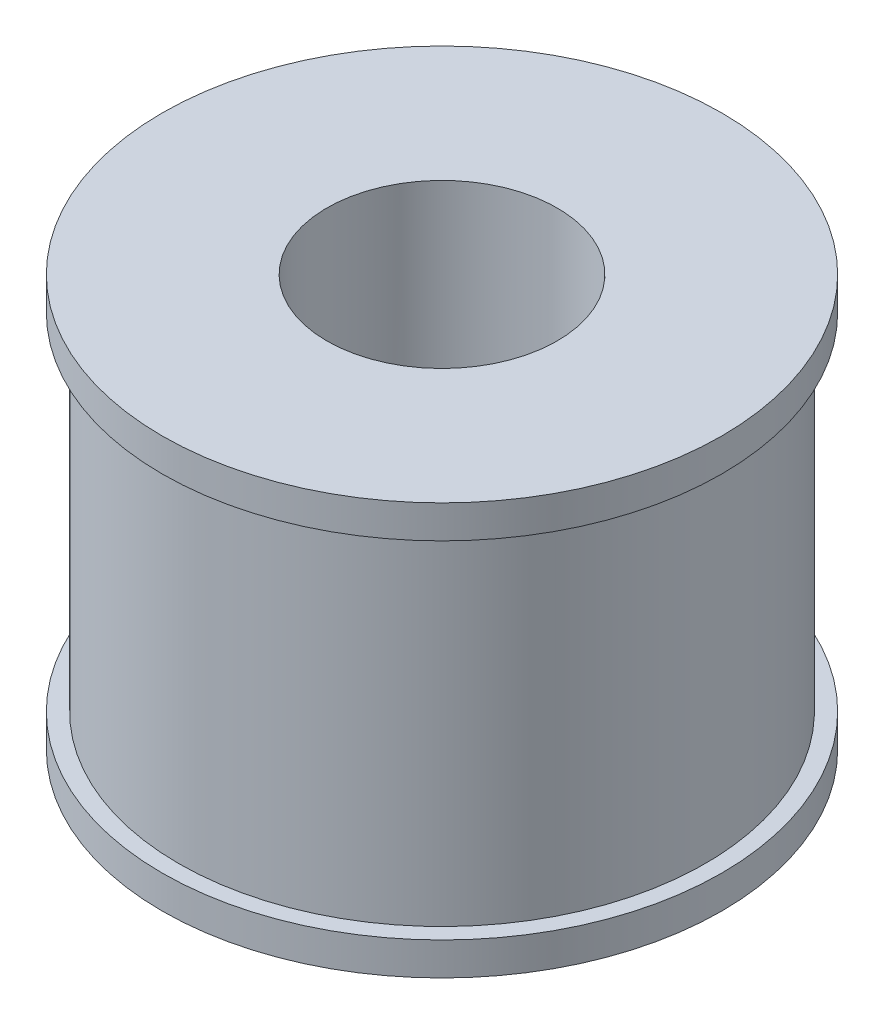
from build123d import *

# Parameters (mm, degrees)
CROQUIS1_R                 = 15
CROQUIS1_R_2               = 3
SALIENTE_EXTRUIR1_DEPTH    = 25
CROQUIS2_R                 = 16.5
CROQUIS2_R_2               = 3
SALIENTE_EXTRUIR2_DEPTH    = 2
SALIENTE_EXTRUIR3_START    = -2
CROQUIS3_R                 = 16.5
CROQUIS3_R_2               = 3
SALIENTE_EXTRUIR3_DEPTH    = 2
CORTAR_EXTRUIR1_REACH      = 36.198
CORTAR_EXTRUIR1_END_RADIUS = 15
CROQUIS4_R                 = 1.625
CROQUIS5_R                 = 7
CORTAR_EXTRUIR2_DEPTH      = 16
CORTAR_EXTRUIR3_DEPTH      = 9
SALIENTE_EXTRUIR5_START    = 21
CROQUIS10_R                = 16
CROQUIS10_R_2              = 15
SALIENTE_EXTRUIR5_DEPTH    = 21
SALIENTE_EXTRUIR6_START    = -2
CROQUIS12_R                = 17
CROQUIS12_R_2              = 16
SALIENTE_EXTRUIR6_DEPTH    = 2
CROQUIS13_R                = 17
CROQUIS13_R_2              = 16
SALIENTE_EXTRUIR7_DEPTH    = 2
CROQUIS14_R                = 3.1
CORTAR_EXTRUIR4_DEPTH      = 10
CROQUIS15_R                = 1.625
CORTAR_EXTRUIR5_DEPTH      = 9


with BuildPart() as part:
    # Croquis1 → Saliente-Extruir1 (new body)
    with BuildSketch(Plane(origin=(0, 0, 0), x_dir=(1, 0, 0), z_dir=(0, 1, 0))):
        with Locations(Location((0, 0, 0), (0, 0, 270))):
            Circle(CROQUIS1_R)
        with Locations(Location((0, 0, 0), (0, 0, 270))):
            Circle(CROQUIS1_R_2, mode=Mode.SUBTRACT)
    extrude(amount=SALIENTE_EXTRUIR1_DEPTH)

    # Croquis2 → Saliente-Extruir2 (add)
    with BuildSketch(Plane.XZ):
        with Locations(Location((0, 0, 0), (0, 0, 270))):
            Circle(CROQUIS2_R)
        with Locations(Location((0, 0, 0), (0, 0, 90))):
            Circle(CROQUIS2_R_2, mode=Mode.SUBTRACT)
    extrude(amount=-SALIENTE_EXTRUIR2_DEPTH)

    # Croquis3 → Saliente-Extruir3 (add)
    with BuildSketch(Plane(origin=(0, 25, 0), x_dir=(1, 0, 0), z_dir=(0, 1, 0)).offset(SALIENTE_EXTRUIR3_START)):
        with Locations(Location((0, 0, 0), (0, 0, 90))):
            Circle(CROQUIS3_R)
        with Locations(Location((0, 0, 0), (0, 0, 270))):
            Circle(CROQUIS3_R_2, mode=Mode.SUBTRACT)
    extrude(amount=SALIENTE_EXTRUIR3_DEPTH)

    # Cortar-Extruir1: up to this cylinder (the profile starts inside it)
    cortar_extruir1_end = Plane(origin=(0, 5, 0), z_dir=(0, -1, 0)) * Cylinder(CORTAR_EXTRUIR1_END_RADIUS, 103.396, mode=Mode.PRIVATE)
    # Croquis4 → Cortar-Extruir1 (cut, up to the surface)
    with BuildSketch(Plane.XY, mode=Mode.PRIVATE) as cortar_extruir1_sk1:
        with Locations((0, 5)):
            Circle(CROQUIS4_R)
    cortar_extruir1_tool1 = extrude(cortar_extruir1_sk1.sketch, amount=-CORTAR_EXTRUIR1_REACH, mode=Mode.PRIVATE) & cortar_extruir1_end
    add(cortar_extruir1_tool1.solids().sort_by_distance((0, 5, 0))[0], mode=Mode.SUBTRACT)

    # Croquis5 → Cortar-Extruir2 (cut)
    with BuildSketch(Plane(origin=(0, 25, 0), x_dir=(1, 0, 0), z_dir=(0, 1, 0))):
        with Locations(Location((0, 0, 0), (0, 0, 270))):
            Circle(CROQUIS5_R)
    extrude(amount=-CORTAR_EXTRUIR2_DEPTH, mode=Mode.SUBTRACT)

    # Croquis7 → Cortar-Extruir3 (cut)
    with BuildSketch(Plane.XZ):
        Polygon((-3.17, -7.5), (3.17, -7.5), (3.17, -4.5), (0, -4.5), (-3.17, -4.5), align=None)
    extrude(amount=-CORTAR_EXTRUIR3_DEPTH, mode=Mode.SUBTRACT)

    # Croquis10 → Saliente-Extruir5 (add)
    with BuildSketch(Plane.XZ.offset(-23).offset(SALIENTE_EXTRUIR5_START)):
        with Locations(Location((0, 0, 0), (0, 0, 90))):
            Circle(CROQUIS10_R)
        Circle(CROQUIS10_R_2, mode=Mode.SUBTRACT)
    extrude(amount=-SALIENTE_EXTRUIR5_DEPTH)

    # Croquis12 → Saliente-Extruir6 (add)
    with BuildSketch(Plane(origin=(0, 2, 0), x_dir=(1, 0, 0), z_dir=(0, 1, 0)).offset(SALIENTE_EXTRUIR6_START)):
        with Locations(Location((0, 0, 0), (0, 0, 270))):
            Circle(CROQUIS12_R)
        with Locations(Location((0, 0, 0), (0, 0, 270))):
            Circle(CROQUIS12_R_2, mode=Mode.SUBTRACT)
    extrude(amount=SALIENTE_EXTRUIR6_DEPTH)

    # Croquis13 → Saliente-Extruir7 (add)
    with BuildSketch(Plane.XZ.offset(-23)):
        with Locations(Location((0, 0, 0), (0, 0, 90))):
            Circle(CROQUIS13_R)
        with Locations(Location((0, 0, 0), (0, 0, 90))):
            Circle(CROQUIS13_R_2, mode=Mode.SUBTRACT)
    extrude(amount=-SALIENTE_EXTRUIR7_DEPTH)

    # Croquis14 → Cortar-Extruir4 (cut)
    with BuildSketch(Plane.XZ):
        with Locations(Location((0, 0, 0), (0, 0, 270))):
            Circle(CROQUIS14_R)
    extrude(amount=-CORTAR_EXTRUIR4_DEPTH, mode=Mode.SUBTRACT)

    # Croquis15 → Cortar-Extruir5 (cut)
    with BuildSketch(Plane.XY.offset(-7.5)):
        with Locations((0, 5)):
            Circle(CROQUIS15_R)
    extrude(amount=-CORTAR_EXTRUIR5_DEPTH, mode=Mode.SUBTRACT)


solid = part.part
